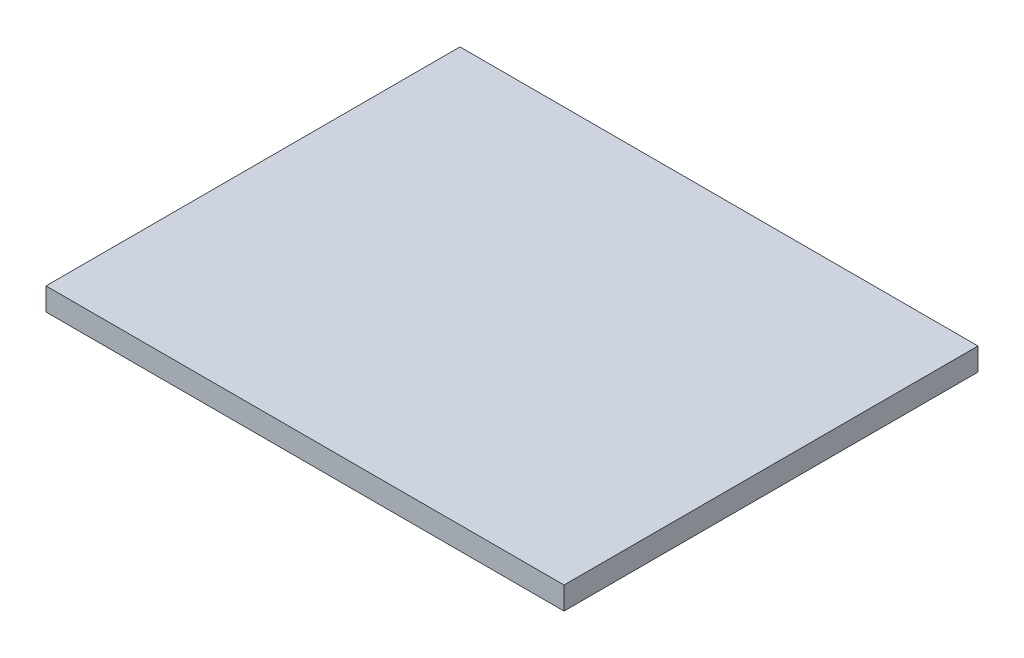
from build123d import *

# Parameters (mm, degrees)
SKETCH1_W           = 45.8
SKETCH1_H           = 36.6
BOSS_EXTRUDE1_DEPTH = 2


with BuildPart() as part:
    # Sketch1 → Boss-Extrude1 (new body)
    with BuildSketch(Plane(origin=(0, 0, 0), x_dir=(1, 0, 0), z_dir=(0, 1, 0))):
        with Locations((-1, 0)):
            Rectangle(SKETCH1_W, SKETCH1_H)
    extrude(amount=BOSS_EXTRUDE1_DEPTH)


solid = part.part
